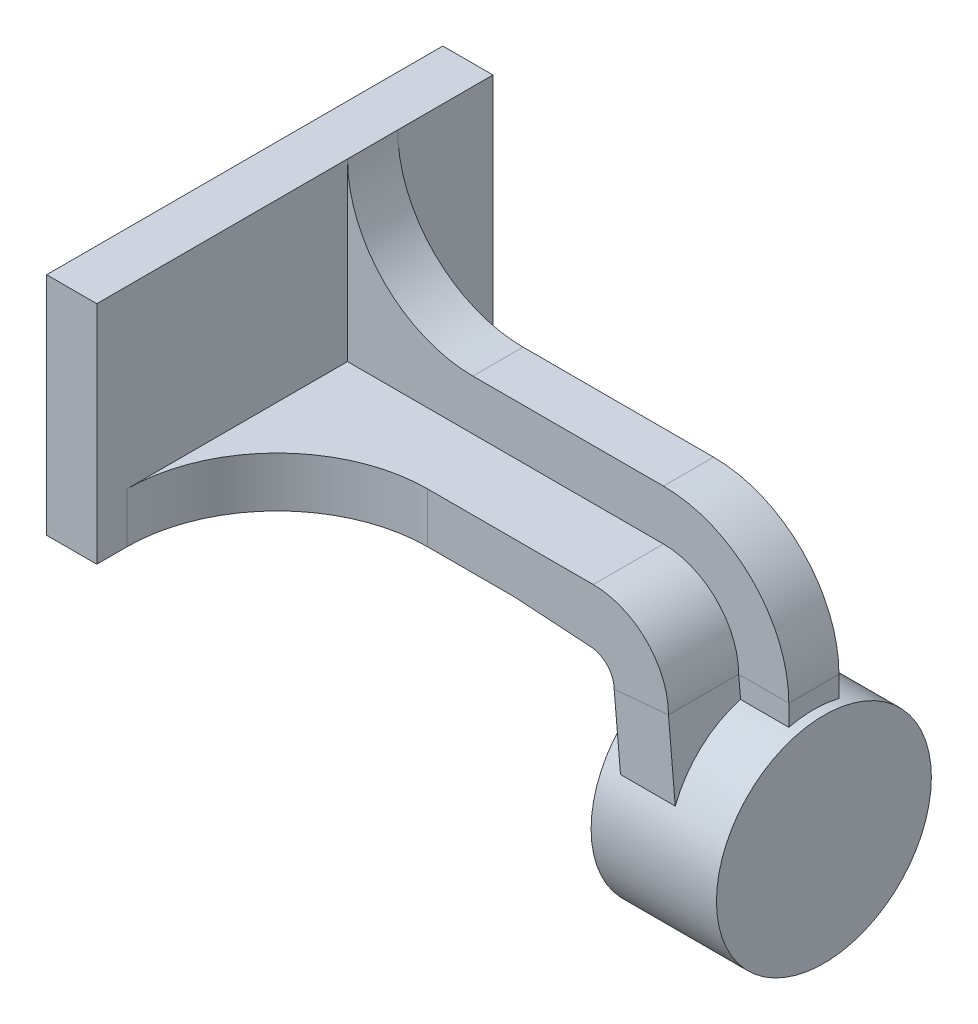
from build123d import *

# Parameters (mm, degrees)
SKETCH1_W            = 79
SKETCH1_H            = 45
BOSS_EXTRUDE1_DEPTH  = 10
BOSS_EXTRUDE2_DEPTH  = 10
BOSS_EXTRUDE11_DEPTH = 10
BOSS_EXTRUDE12_START = 14
BOSS_EXTRUDE12_DEPTH = 14
SKETCH8_R            = 16
BOSS_EXTRUDE15_DEPTH = 23
SKETCH11_R           = 16
BOSS_EXTRUDE16_DEPTH = 2
SKETCH14_W           = 10
SKETCH14_H           = 10
BOSS_EXTRUDE20_DEPTH = 11
SKETCH15_W           = 10.870824636
SKETCH15_H           = 14
BOSS_EXTRUDE21_DEPTH = 29
SKETCH16_R           = 21.427999152
BOSS_EXTRUDE22_DEPTH = 25


with BuildPart() as part:
    # Sketch1 → Boss-Extrude1 (new body)
    with BuildSketch(Plane(origin=(0, 0, 0), x_dir=(0, 0, -1), z_dir=(1, 0, 0))):
        with Locations((-40.611276675, 17.572019258)):
            Rectangle(SKETCH1_W, SKETCH1_H)
    extrude(amount=BOSS_EXTRUDE1_DEPTH)

    # Sketch3 → Boss-Extrude2 (add)
    with BuildSketch(Plane.XY.offset(30.111276675)):
        with BuildLine():
            ThreePointArc((35, 15.072019258), (17.32233047, 22.394349729), (10, 40.072019258))
            Line((10, 40.072019258), (10, 15.072019258))
            Line((10, 15.072019258), (10, 5.072019258))
            Line((10, 5.072019258), (73, 5.072019258))
            ThreePointArc((73, 5.072019258), (83.606601718, 0.678620976), (88, -9.927980742))
            Line((88, -9.927980742), (98, -9.927980742))
            ThreePointArc((98, -9.927980742), (90.67766953, 7.749688788), (73, 15.072019258))
            Line((73, 15.072019258), (35, 15.072019258))
        make_face()
    extrude(amount=-BOSS_EXTRUDE2_DEPTH)


with BuildPart() as body_2:
    # Sketch5 → Boss-Extrude11 (new body)
    with BuildSketch(Plane(origin=(0, 5.072019258, 0), x_dir=(1, 0, 0), z_dir=(0, 1, 0))):
        with BuildLine():
            Line((57.363847246, -30.111276675), (10, -30.111276675))
            Line((10, -30.111276675), (10, -74.111276675))
            ThreePointArc((10, -74.111276675), (18.786796564, -52.898073239), (40, -44.111276675))
            Line((40, -44.111276675), (57.363847246, -44.111276675))
            Line((57.363847246, -44.111276675), (57.363847246, -30.111276675))
        make_face()
    extrude(amount=-BOSS_EXTRUDE11_DEPTH)

    # Sketch7 → Boss-Extrude12 (add)
    with BuildSketch(Plane.XY.offset(30.111276675).offset(BOSS_EXTRUDE12_START)):
        with BuildLine():
            Line((57.363847246, 5.072019258), (73, 5.072019258))
            ThreePointArc((73, 5.072019258), (83.606601718, 0.678620976), (88, -9.927980742))
            Line((88, -9.927980742), (77.17250833, -10.897646868))
            ThreePointArc((77.17250833, -10.897646868), (75.708042236, -7.362112962), (72.17250833, -5.897646868))
            Line((72.17250833, -5.897646868), (57.363847246, -4.927980742))
            Line((57.363847246, -4.927980742), (57.363847246, 5.072019258))
        make_face()
    extrude(amount=-BOSS_EXTRUDE12_DEPTH)


with BuildPart() as body_3:
    # Sketch8 → Boss-Extrude15 (new body)
    with BuildSketch(Plane(origin=(98, 0, 0), x_dir=(0, 0, -1), z_dir=(1, 0, 0))):
        with Locations((-25.111276675, -34.927980742)):
            Circle(SKETCH8_R)
    extrude(amount=-BOSS_EXTRUDE15_DEPTH)

    # Sketch11 → Boss-Extrude16 (add)
    with BuildSketch(Plane(origin=(98, 0, 0), x_dir=(0, 0, -1), z_dir=(1, 0, 0))):
        with Locations((-25.111276675, -34.927980742)):
            Circle(SKETCH11_R)
    extrude(amount=BOSS_EXTRUDE16_DEPTH)



with BuildPart() as body_4:
    # Sketch14 → Boss-Extrude20 (new body)
    with BuildSketch(Plane.XZ.offset(9.927980742)):
        with Locations((93, 25.111276675)):
            Rectangle(SKETCH14_W, SKETCH14_H)
    extrude(amount=BOSS_EXTRUDE20_DEPTH)


with BuildPart() as body_5:
    # Sketch15 → Boss-Extrude21 (new body)
    with BuildSketch(Plane(origin=(1.582203238, -17.667207218, 0), x_dir=(0.996013829020688, 0.08919894842176003, 0), z_dir=(0.08919894842176003, -0.996013829020688, 0))):
        with Locations((81.328239194, 37.111276675)):
            Rectangle(SKETCH15_W, SKETCH15_H)
    extrude(amount=BOSS_EXTRUDE21_DEPTH)


with BuildPart() as body_3_1:
    add(body_3.part)

    add(body_4.part)  # Boss-Extrude22 merges body 4

    add(body_5.part)  # Boss-Extrude22 merges body 5
    # Sketch16 → Boss-Extrude22 (add)
    with BuildSketch(Plane(origin=(100, 0, 0), x_dir=(0, 0, -1), z_dir=(1, 0, 0))):
        with Locations((-25.111276675, -34.927980742)):
            Circle(SKETCH16_R)
    extrude(amount=-BOSS_EXTRUDE22_DEPTH)


solid = Compound([part.part, body_2.part, body_3_1.part])
